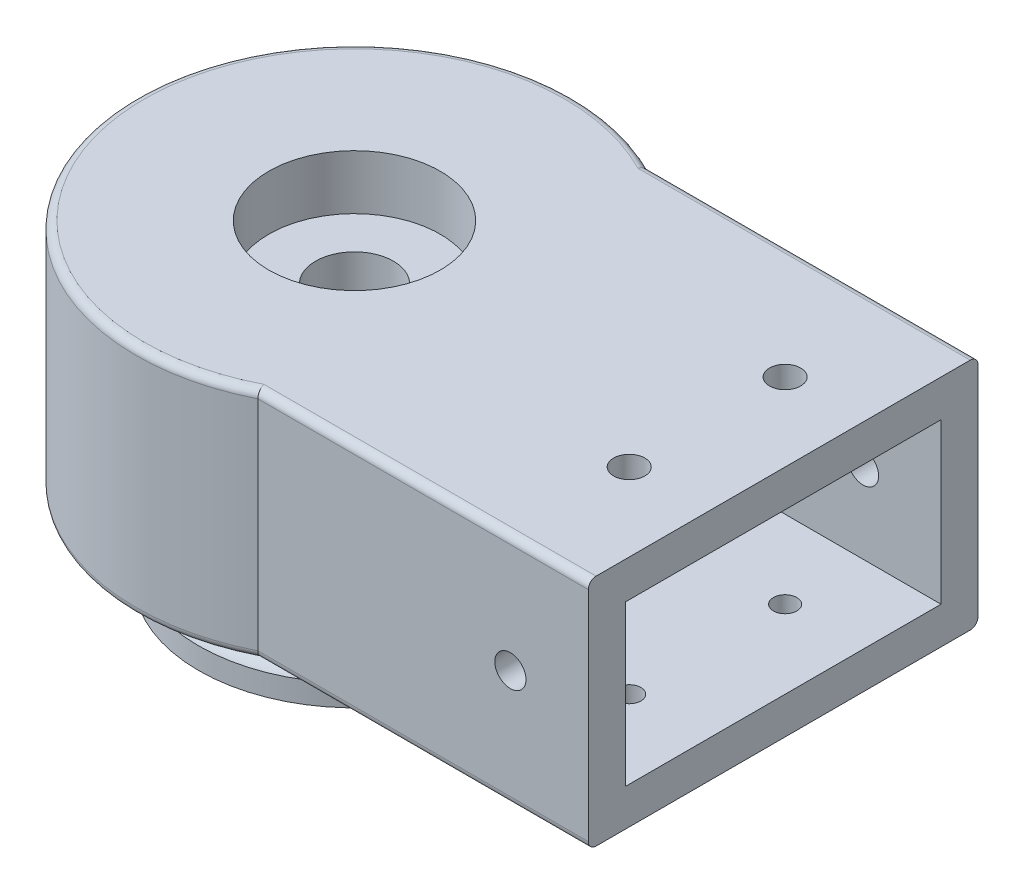
from build123d import *

# Parameters (mm, degrees)
BOSS_EXTRUDE2_DEPTH     = 30
SKETCH5_R               = 11
CUT_EXTRUDE1_DEPTH      = 7
SKETCH6_R               = 5
CUT_EXTRUDE2_DEPTH      = 40
CUT_EXTRUDE3_START      = -7
SKETCH7_R               = 11
CUT_EXTRUDE3_DEPTH      = 7
SKETCH8_W               = 40.5
SKETCH8_H               = 20.5
CUT_EXTRUDE4_DEPTH      = 45
SKETCH9_W               = 15
SKETCH9_H               = 50
CUT_EXTRUDE5_DEPTH      = 45
CUT_EXTRUDE6_DEPTH      = 45
CUT_EXTRUDE6_DEPTH_BACK = 45
SKETCH10_R              = 2
CUT_EXTRUDE7_DEPTH      = 50
CUT_EXTRUDE7_DEPTH_BACK = 45
SKETCH11_R              = 2
FILLET1_R               = 1
SKETCH13_R              = 2
SKETCH13_R_2            = 1.5
BOSS_EXTRUDE3_DEPTH     = 4.75
SKETCH14_R              = 2.5
CUT_EXTRUDE8_DEPTH      = 2.2


with BuildPart() as part:
    # Sketch1 → Revolve2 (revolve)
    with BuildSketch(Plane.XY, mode=Mode.PRIVATE) as revolve2_sk:
        with BuildLine():
            Line((0, 2.25), (0, 5))
            Line((0, 5), (-20, 5))
            Line((-20, 5), (-20, -5))
            Line((-20, -5), (0, -5))
            Line((0, -5), (0, -2.25))
            ThreePointArc((0, -2.25), (-2.25, 0), (0, 2.25))
        make_face()
    revolve(revolve2_sk.sketch.rotate(Axis((-20, 5, 0), (0, -1, 0)), 90), axis=Axis((-20, 5, 0), (0, -1, 0)))

    # Sketch4 → Boss-Extrude2 (add)
    with BuildSketch(Plane(origin=(0, 5, 0), x_dir=(1, 0, 0), z_dir=(0, 1, 0))):
        with BuildLine():
            Line((-7.390479787, 25), (50, 25))
            Line((50, 25), (50, -25))
            Line((50, -25), (-7.390479787, -25))
            ThreePointArc((-7.390479787, -25), (-48, 0), (-7.390479787, 25))
        make_face()
    extrude(amount=BOSS_EXTRUDE2_DEPTH)

    # Sketch5 → Cut-Extrude1 (cut)
    with BuildSketch(Plane.XZ.offset(5)):
        with Locations(Location((-20, 0, 0), (0, 0, 270))):
            Circle(SKETCH5_R)
    extrude(amount=-CUT_EXTRUDE1_DEPTH, mode=Mode.SUBTRACT)

    # Sketch6 → Cut-Extrude2 (cut)
    with BuildSketch(Plane.XZ.offset(-2)):
        with Locations(Location((-20, 0, 0), (0, 0, 270))):
            Circle(SKETCH6_R)
    extrude(amount=-CUT_EXTRUDE2_DEPTH, mode=Mode.SUBTRACT)

    # Sketch7 → Cut-Extrude3 (cut)
    with BuildSketch(Plane(origin=(0, 35, 0), x_dir=(1, 0, 0), z_dir=(0, 1, 0)).offset(CUT_EXTRUDE3_START)):
        with Locations(Location((-20, 0, 0), (0, 0, 90))):
            Circle(SKETCH7_R)
    extrude(amount=CUT_EXTRUDE3_DEPTH, mode=Mode.SUBTRACT)

    # Sketch8 → Cut-Extrude4 (cut)
    with BuildSketch(Plane(origin=(50, 0, 0), x_dir=(0, 0, -1), z_dir=(1, 0, 0))):
        with Locations((0, 20)):
            Rectangle(SKETCH8_W, SKETCH8_H)
    extrude(amount=-CUT_EXTRUDE4_DEPTH, mode=Mode.SUBTRACT)

    # Sketch9 → Cut-Extrude5 (cut)
    with BuildSketch(Plane(origin=(0, 35, 0), x_dir=(1, 0, 0), z_dir=(0, 1, 0))):
        with Locations((42.5, 0)):
            Rectangle(SKETCH9_W, SKETCH9_H)
    extrude(amount=-CUT_EXTRUDE5_DEPTH, mode=Mode.SUBTRACT)

    # Sketch10 → Cut-Extrude6 (cut, two sides: drawn at the far end of the back side and taken through both)
    with BuildSketch(Plane.XZ.offset(-30.25).offset(-CUT_EXTRUDE6_DEPTH_BACK)):
        with Locations(Location((25, 9.75, 0), (0, 0, 90))):
            Circle(SKETCH10_R)
        with Locations(Location((25, -10.25, 0), (0, 0, 90))):
            Circle(SKETCH10_R)
    extrude(amount=CUT_EXTRUDE6_DEPTH + CUT_EXTRUDE6_DEPTH_BACK, mode=Mode.SUBTRACT)

    # Sketch11 → Cut-Extrude7 (cut, two sides: drawn at the far end of the back side and taken through both)
    with BuildSketch(Plane.XY.offset(-20.25).offset(-CUT_EXTRUDE7_DEPTH_BACK)):
        with Locations(Location((25, 20, 0), (0, 0, 90))):
            Circle(SKETCH11_R)
    extrude(amount=CUT_EXTRUDE7_DEPTH + CUT_EXTRUDE7_DEPTH_BACK, mode=Mode.SUBTRACT)

    # Fillet1
    fillet1_edges = [part.edges().sort_by_distance(p)[0] for p in [
        (-48, 5, 0),
        (13.804760106, 5, 25),
        (-48, 35, 0),
        (13.804760106, 35, 25),
        (13.804760106, 35, -25),
        (13.804760106, 5, -25),
    ]]
    fillet(fillet1_edges, radius=FILLET1_R)

    # Sketch13 → Boss-Extrude3 (add)
    # profile 1 of 2: a face of its own
    with BuildSketch(Plane.XZ.offset(-5)):
        with Locations(Location((25, 9.75, 0), (0, 0, 90))):
            Circle(SKETCH13_R)
        with Locations(Location((25, 9.75, 0), (0, 0, 270))):
            Circle(SKETCH13_R_2, mode=Mode.SUBTRACT)
    # profile 2 of 2: a face of its own
    with BuildSketch(Plane.XZ.offset(-5)):
        with Locations(Location((25, -10.25, 0), (0, 0, 90))):
            Circle(SKETCH13_R)
        with Locations(Location((25, -10.25, 0), (0, 0, 270))):
            Circle(SKETCH13_R_2, mode=Mode.SUBTRACT)
    extrude(amount=-BOSS_EXTRUDE3_DEPTH)

    # Sketch14 → Cut-Extrude8 (cut)
    with BuildSketch(Plane.XZ.offset(-5)):
        with Locations(Location((25, 9.75, 0), (0, 0, 270))):
            Circle(SKETCH14_R)
        with Locations(Location((25, -10.25, 0), (0, 0, 270))):
            Circle(SKETCH14_R)
    extrude(amount=-CUT_EXTRUDE8_DEPTH, mode=Mode.SUBTRACT)


solid = part.part
